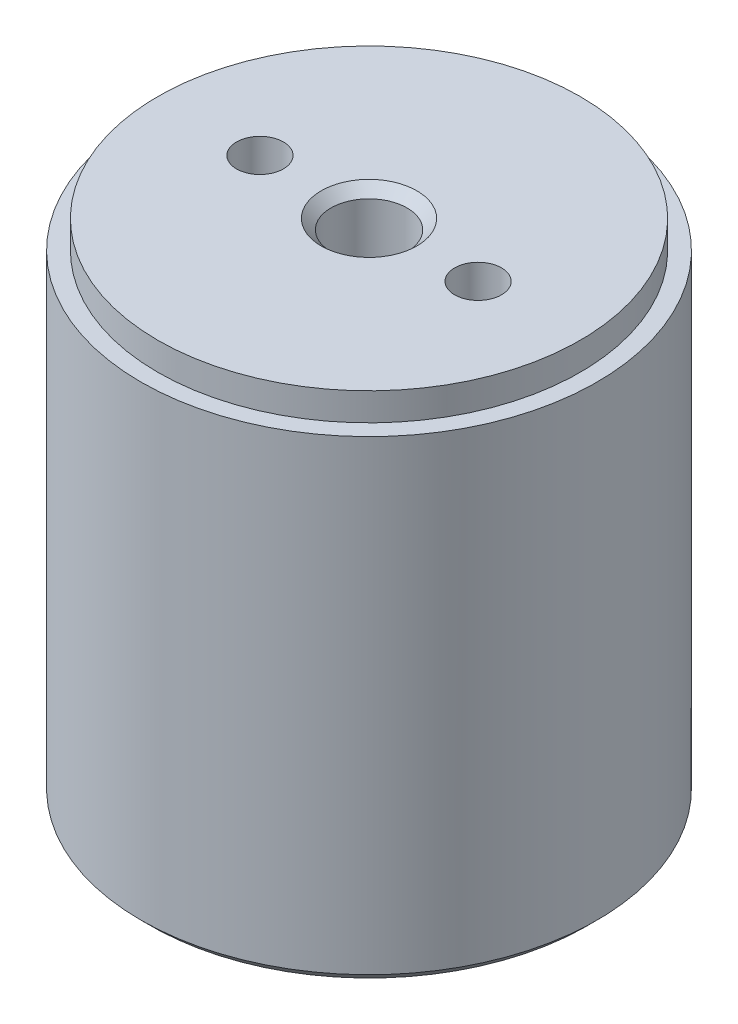
from build123d import *

# Parameters (mm, degrees)
SKETCH2_R                  = 10.65
BOSS_EXTRUDE1_DEPTH        = 1.4
M2_CLEARANCE_HOLE1_D       = 2.362
M2_CLEARANCE_HOLE1_DEPTH   = 5
M2_CLEARANCE_HOLE2_D       = 2.362
M2_CLEARANCE_HOLE2_DEPTH   = 9
M3_5_CLEARANCE_HOLE1_D     = 3.83
M3_5_CLEARANCE_HOLE1_DEPTH = 5
M2_CLEARANCE_HOLE3_D       = 2.362
M2_CLEARANCE_HOLE3_DEPTH   = 5
CHAMFER1_SIZE              = 0.498


with BuildPart() as part:
    # Sketch1 → Revolve1 (revolve)
    with BuildSketch(Plane(origin=(0, 0, 0), x_dir=(-1, 0, 0), z_dir=(0, 0, -1)), mode=Mode.PRIVATE) as revolve1_sk:
        with BuildLine():
            Line((-2.413, -4), (0, -4))
            Line((0, -4), (0, 24))
            Line((0, 24), (-11.5, 24))
            Line((-11.5, 24), (-11.5, 0))
            Line((-11.5, 0), (-8.835106781, 0))
            ThreePointArc((-8.835106781, 0), (-8.128, -0.5), (-7.420893219, 0))
            Line((-7.420893219, 0), (-3.602106781, 0))
            ThreePointArc((-3.602106781, 0), (-3.092512244, -0.473525337), (-2.413, -0.324609433))
            Line((-2.413, -0.324609433), (-2.413, -4))
        make_face()
    revolve(revolve1_sk.sketch.rotate(Axis((0, -4, 0), (0, 1, 0)), 270), axis=Axis((0, -4, 0), (0, 1, 0)))

    # Sketch2 → Boss-Extrude1 (add)
    with BuildSketch(Plane(origin=(0, 24, 0), x_dir=(-1, 0, 0), z_dir=(0, 1, 0))):
        with Locations(Location((0, 0, 0), (0, 0, 90))):
            Circle(SKETCH2_R)
    extrude(amount=BOSS_EXTRUDE1_DEPTH)

    # M2 Clearance Hole1
    with Locations(Plane(origin=(0, 0, 0), x_dir=(-1, 0, 0), z_dir=(0, -1, 0))):
        with Locations((-5.5, 0), (5.5, 0)):
            Hole(M2_CLEARANCE_HOLE1_D / 2, depth=M2_CLEARANCE_HOLE1_DEPTH)

    # M2 Clearance Hole2
    with Locations(Plane(origin=(0, -4, 0), x_dir=(-1, 0, 0), z_dir=(0, -1, 0))):
        with Locations((0, 0)):
            Hole(M2_CLEARANCE_HOLE2_D / 2, depth=M2_CLEARANCE_HOLE2_DEPTH)

    # M3.5 Clearance Hole1
    with Locations(Plane(origin=(0, 25.4, 0), x_dir=(1, 0, 0), z_dir=(0, 1, 0))):
        with Locations((0, 0)):
            Hole(M3_5_CLEARANCE_HOLE1_D / 2, depth=M3_5_CLEARANCE_HOLE1_DEPTH)

    # M2 Clearance Hole3
    with Locations(Plane(origin=(0, 25.4, 0), x_dir=(1, 0, 0), z_dir=(0, 1, 0))):
        with Locations((5.5, 0), (-5.5, 0)):
            Hole(M2_CLEARANCE_HOLE3_D / 2, depth=M2_CLEARANCE_HOLE3_DEPTH)

    # Chamfer1
    chamfer1_edges = [part.edges().sort_by_distance(p)[0] for p in [
        (0, -4, -2.413),
        (1.915, 25.4, 0),
        (0, 0, -11.5),
    ]]
    chamfer(chamfer1_edges, length=CHAMFER1_SIZE)


solid = part.part
